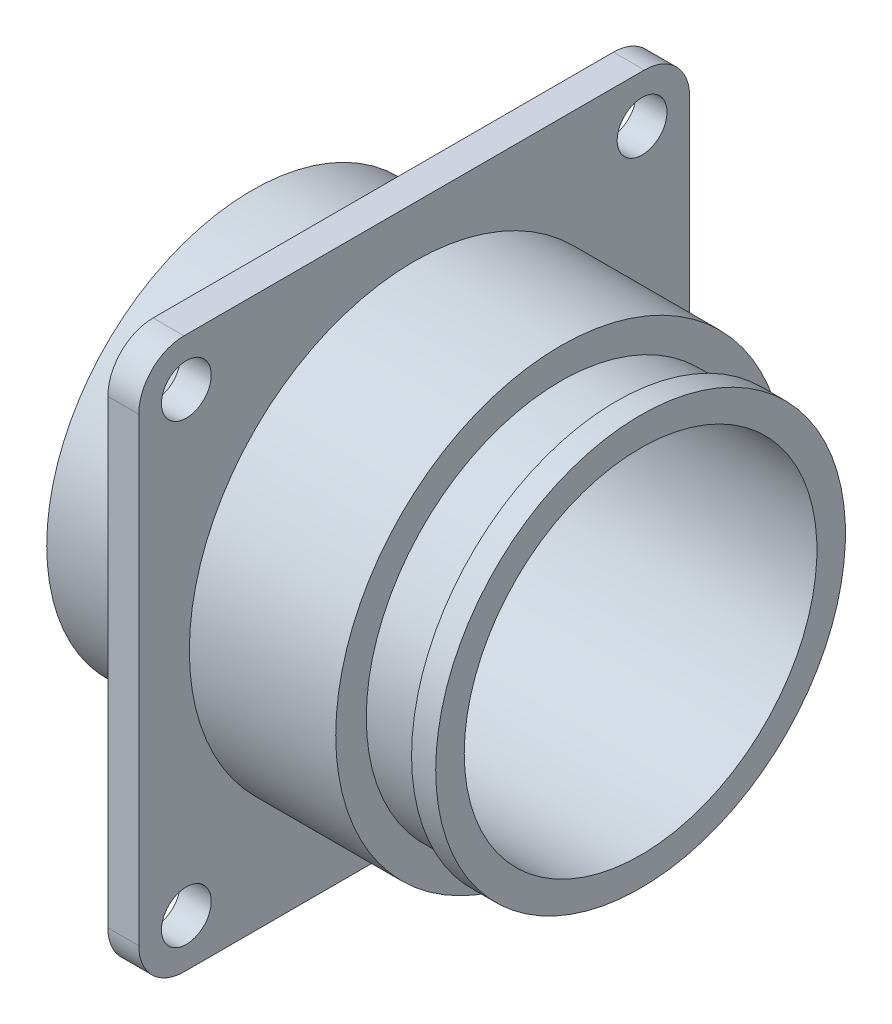
from build123d import *

# Parameters (mm, degrees)
CROQUIS1_R              = 1.65
CROQUIS1_R_2            = 14.9
SALIENTE_EXTRUIR1_DEPTH = 2.05


with BuildPart() as part:
    # Croquis1 → Saliente-Extruir1 (new body)
    with BuildSketch(Plane(origin=(0, 0, 0), x_dir=(0, 0, -1), z_dir=(1, 0, 0))):
        with BuildLine():
            Line((-15.25, -18.25), (15.25, -18.25))
            ThreePointArc((15.25, -18.25), (17.371320344, -17.371320344), (18.25, -15.25))
            Line((18.25, -15.25), (18.25, 15.25))
            ThreePointArc((18.25, 15.25), (17.371320344, 17.371320344), (15.25, 18.25))
            Line((15.25, 18.25), (-15.25, 18.25))
            ThreePointArc((-15.25, 18.25), (-17.371320344, 17.371320344), (-18.25, 15.25))
            Line((-18.25, 15.25), (-18.25, -15.25))
            ThreePointArc((-18.25, -15.25), (-17.371320344, -17.371320344), (-15.25, -18.25))
        make_face()
        with Locations((-15.1, 15.1)):
            Circle(CROQUIS1_R, mode=Mode.SUBTRACT)
        with Locations((-15.1, -15.1)):
            Circle(CROQUIS1_R, mode=Mode.SUBTRACT)
        with Locations((15.1, -15.1)):
            Circle(CROQUIS1_R, mode=Mode.SUBTRACT)
        with Locations((15.1, 15.1)):
            Circle(CROQUIS1_R, mode=Mode.SUBTRACT)
        Circle(CROQUIS1_R_2, mode=Mode.SUBTRACT)
    extrude(amount=SALIENTE_EXTRUIR1_DEPTH)

    # Croquis2 → Revolución1 (revolve)
    with BuildSketch(Plane.XY, mode=Mode.PRIVATE) as revoluci_n1_sk:
        Polygon((0, 14.9), (11.75, 14.9), (11.75, 12.875), (15.45, 12.875), (15.45, 13.575), (17.05, 13.575), (17.05, 11.685), (-3.25, 11.685), (-3.25, 9), (-8.7, 9), (-8.7, 13.6), (0, 13.6), align=None)
    revolve(revoluci_n1_sk.sketch.rotate(Axis((0, 0, 0), (1, 0, 0)), 90), axis=Axis((0, 0, 0), (1, 0, 0)))


solid = part.part
